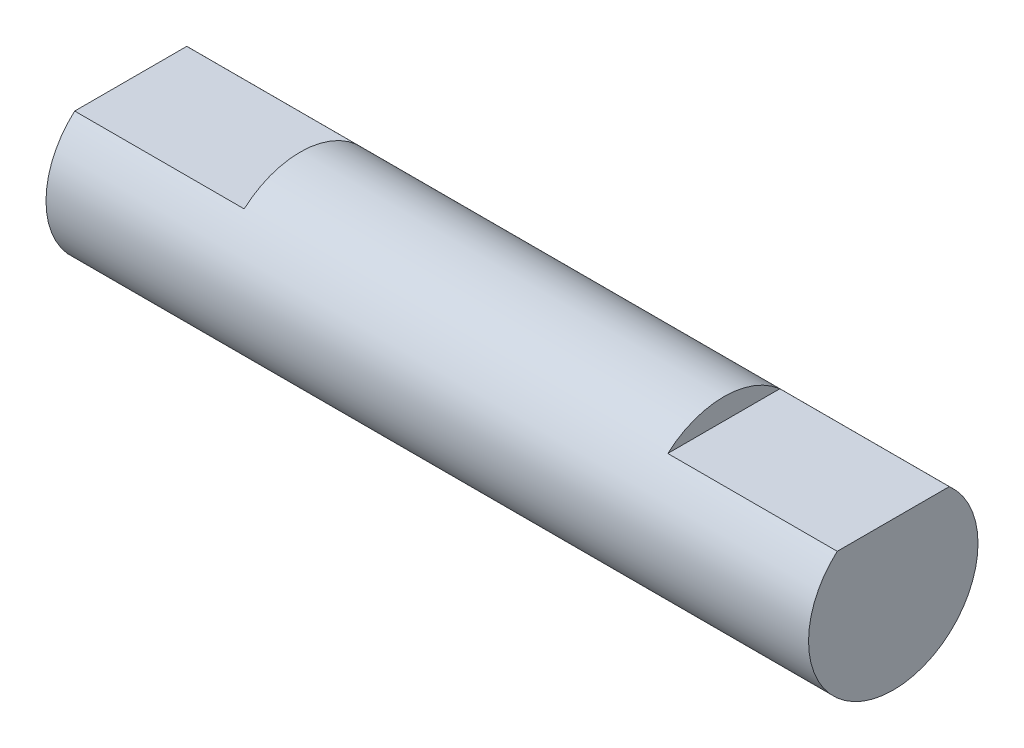
from build123d import *

# Parameters (mm, degrees)
SKETCH1_R           = 3.175
BOSS_EXTRUDE1_DEPTH = 28.575
SKETCH2_W           = 9.525
SKETCH2_H           = 1.5875
CUT_EXTRUDE1_DEPTH  = 6.35


with BuildPart() as part:
    # Sketch1 → Boss-Extrude1 (new body)
    with BuildSketch(Plane(origin=(0, 0, 0), x_dir=(0, 0, -1), z_dir=(1, 0, 0))):
        Circle(SKETCH1_R)
    extrude(amount=BOSS_EXTRUDE1_DEPTH)

    # Sketch2 → Cut-Extrude1 (cut)
    with BuildSketch(Plane(origin=(28.575, 0, 0), x_dir=(0, 0, -1), z_dir=(1, 0, 0))):
        with Locations((0, 3.175)):
            Rectangle(SKETCH2_W, SKETCH2_H)
    cut_extrude1 = extrude(amount=-CUT_EXTRUDE1_DEPTH, mode=Mode.SUBTRACT)

    # Mirror1: Cut-Extrude1 across plane
    add(cut_extrude1.mirror(Plane(origin=(14.2875, 0, 0), x_dir=(0, 0, 1), z_dir=(1, 0, 0))), mode=Mode.SUBTRACT)


solid = part.part
